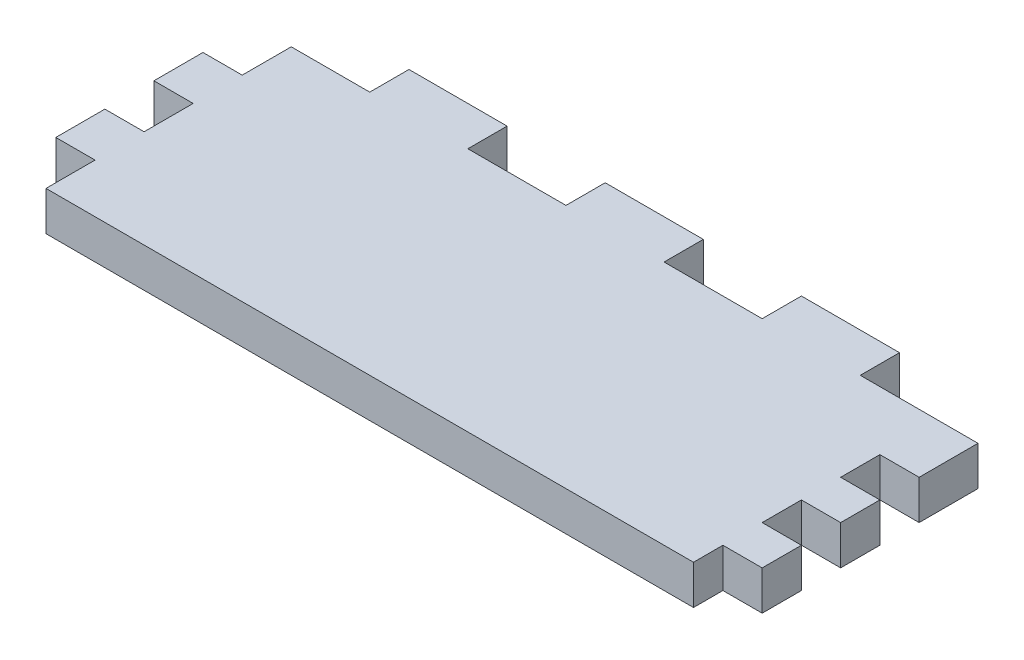
from build123d import *

# Parameters (mm, degrees)
SKETCH1_W           = 66
SKETCH1_H           = 25
BOSS_EXTRUDE1_DEPTH = 4
SKETCH2_W           = 4
SKETCH2_H           = 5
BOSS_EXTRUDE2_DEPTH = 4
LPATTERN1_COUNT     = 2
LPATTERN1_PITCH     = 10
SKETCH3_W           = 10
SKETCH3_H           = 4
BOSS_EXTRUDE3_DEPTH = 4
LPATTERN2_COUNT     = 2
LPATTERN2_PITCH     = 20
LPATTERN2_COL_COUNT = 2
LPATTERN2_COL_PITCH = 20
SKETCH5_W           = 4
SKETCH5_H           = 6
SKETCH5_H_2         = 4
BOSS_EXTRUDE4_DEPTH = 4


with BuildPart() as part:
    # Sketch1 → Boss-Extrude1 (new body)
    with BuildSketch(Plane(origin=(0, 0, 0), x_dir=(1, 0, 0), z_dir=(0, 1, 0))):
        with Locations((33, -12.5)):
            Rectangle(SKETCH1_W, SKETCH1_H)
    extrude(amount=BOSS_EXTRUDE1_DEPTH)

    # Sketch2 → Boss-Extrude2 (add, through all)
    with BuildSketch(Plane(origin=(0, 4, 0), x_dir=(1, 0, 0), z_dir=(0, 1, 0))):
        with Locations((-2, -7.5)):
            Rectangle(SKETCH2_W, SKETCH2_H)
    boss_extrude2 = extrude(amount=-BOSS_EXTRUDE2_DEPTH)

    # LPattern1: Boss-Extrude2 ×2
    with Locations(*[(0, 0, i * LPATTERN1_PITCH) for i in range(1, LPATTERN1_COUNT)]):
        add(boss_extrude2)

    # Sketch3 → Boss-Extrude3 (add, through all)
    with BuildSketch(Plane(origin=(0, 4, 0), x_dir=(1, 0, 0), z_dir=(0, 1, 0))):
        with Locations((33, 2)):
            Rectangle(SKETCH3_W, SKETCH3_H)
    boss_extrude3 = extrude(amount=-BOSS_EXTRUDE3_DEPTH)

    # LPattern2: Boss-Extrude3 ×2
    with Locations(*[(i * LPATTERN2_PITCH, 0, 0) for i in range(1, LPATTERN2_COUNT)]):
        add(boss_extrude3)

    # LPattern2 col: Boss-Extrude3 ×2
    with Locations(*[(-i * LPATTERN2_COL_PITCH, 0, 0) for i in range(1, LPATTERN2_COL_COUNT)]):
        add(boss_extrude3)

    # Sketch5 → Boss-Extrude4 (add, through all)
    with BuildSketch(Plane(origin=(0, 4, 0), x_dir=(1, 0, 0), z_dir=(0, 1, 0))):
        with Locations((68, -3)):
            Rectangle(SKETCH5_W, SKETCH5_H)
        with Locations((68, -12)):
            Rectangle(SKETCH5_W, SKETCH5_H_2)
        with Locations((68, -20)):
            Rectangle(SKETCH5_W, SKETCH5_H_2)
    extrude(amount=-BOSS_EXTRUDE4_DEPTH)


solid = part.part
